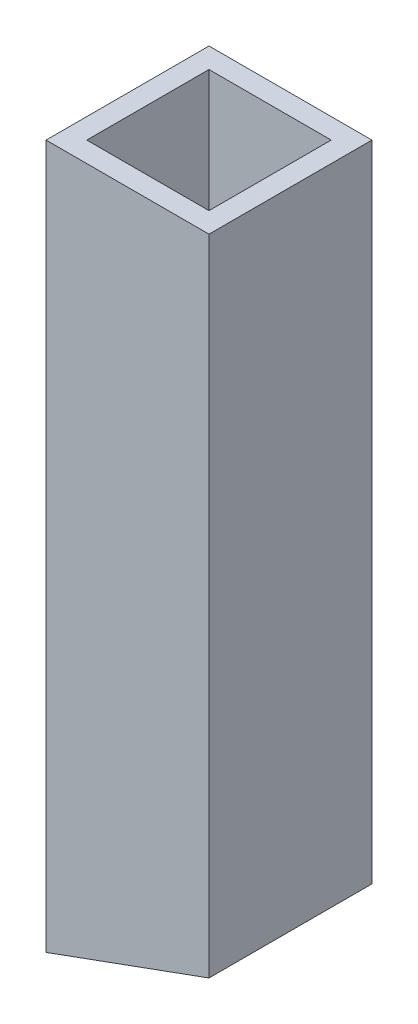
from build123d import *

# Parameters (mm, degrees)
BOSS_EXTRUDE1_DEPTH = 12.7
SKETCH2_W           = 19.05
SKETCH2_H           = 19.05
CUT_EXTRUDE1_DEPTH  = 112.125209326


with BuildPart() as part:
    # Sketch1 → Boss-Extrude1 (new, symmetric)
    with BuildSketch(Plane.XY):
        Polygon((-12.7, -54.832089482), (12.7, -45.587245531), (12.7, 54.832089482), (-12.7, 54.832089482), align=None)
    extrude(amount=BOSS_EXTRUDE1_DEPTH, both=True)

    # Sketch2 → Cut-Extrude1 (cut, through all)
    with BuildSketch(Plane(origin=(0, 54.832089482, 0), x_dir=(1, 0, 0), z_dir=(0, 1, 0))):
        Rectangle(SKETCH2_W, SKETCH2_H)
    extrude(amount=-CUT_EXTRUDE1_DEPTH, mode=Mode.SUBTRACT)


solid = part.part
